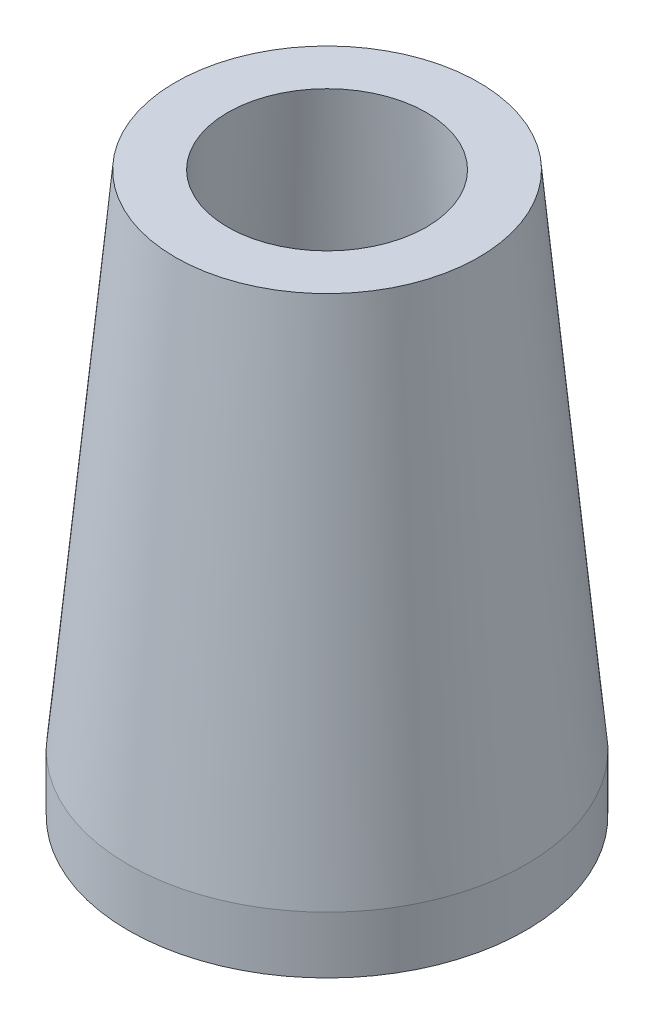
from build123d import *


with BuildPart() as part:
    # Sketch1 → Revolve2 (revolve)
    with BuildSketch(Plane.XY, mode=Mode.PRIVATE) as revolve2_sk:
        Polygon((434.018241684, 194.999945769), (444.018241684, 194.999945769), (444.018241684, 204.99994577), (445.814577674, 204.99994577), (452.99916868, 301.99877873), (442.99916868, 301.99877873), (434.018241684, 205.895851075), align=None)
    revolve(revolve2_sk.sketch.rotate(Axis((471.999750168, 301.998369033, 0), (0, -1, 0)), 270), axis=Axis((471.999750168, 301.998369033, 0), (0, -1, 0)))


solid = part.part
